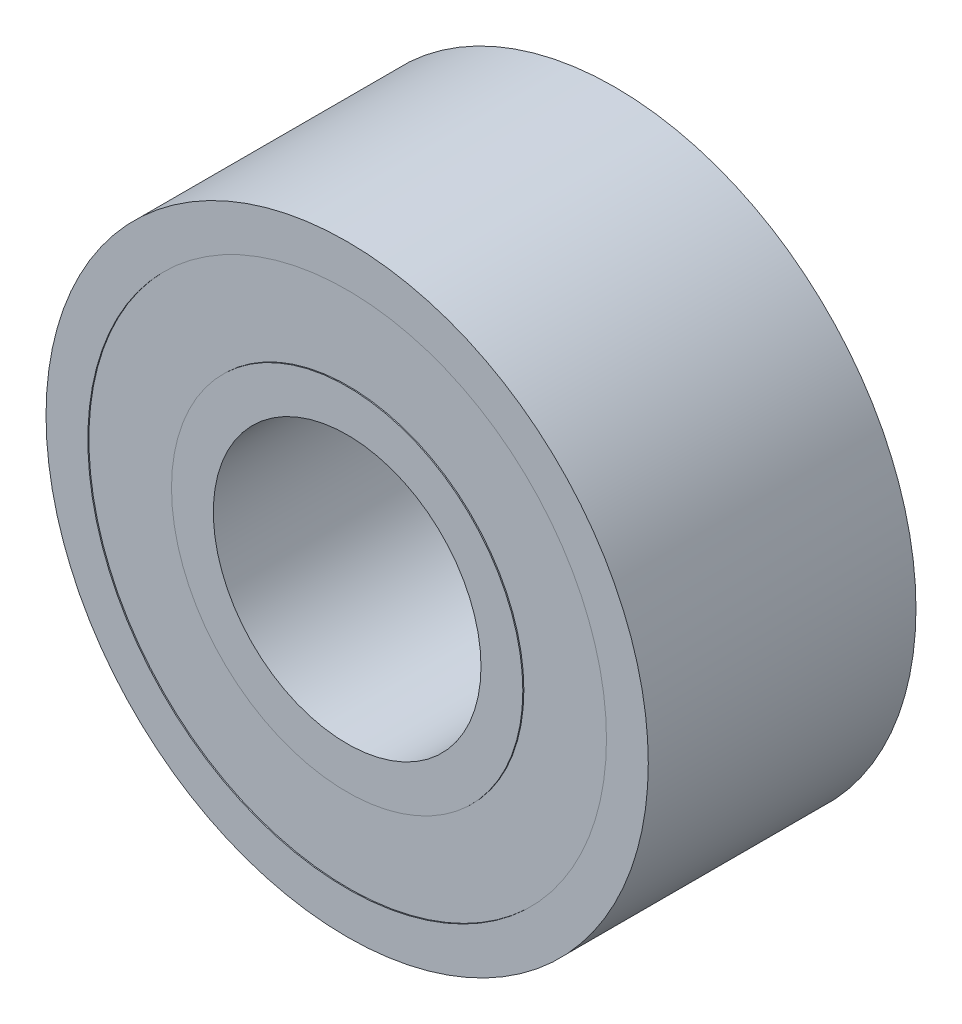
from build123d import *

# Parameters (mm, degrees)
BOSS_EXTRUDE1_DEPTH        = 2
BOSS_EXTRUDE1_DEPTH_BACK   = 2
SKETCH1_R                  = 2.625
SKETCH1_R_2                = 2
BOSS_EXTRUDE1_2_DEPTH      = 2
BOSS_EXTRUDE1_2_DEPTH_BACK = 2
SKETCH1_R_3                = 4.5
SKETCH1_R_4                = 3.875
BOSS_EXTRUDE2_DEPTH        = 1.984375
BOSS_EXTRUDE2_DEPTH_BACK   = 1.984375
SKETCH1_3_R                = 3.875
SKETCH1_3_R_2              = 2.625


with BuildPart() as part:
    # Sketch1 → Boss-Extrude1 (new, two sides: drawn at the far end of the back side and taken through both)
    with BuildSketch(Plane.XY.offset(-BOSS_EXTRUDE1_DEPTH_BACK)):
        Circle(SKETCH1_R)
        Circle(SKETCH1_R_2, mode=Mode.SUBTRACT)
    extrude(amount=BOSS_EXTRUDE1_DEPTH + BOSS_EXTRUDE1_DEPTH_BACK)



with BuildPart() as body_2:
    # Sketch1 → Boss-Extrude1 2 (new, two sides: drawn at the far end of the back side and taken through both)
    with BuildSketch(Plane.XY.offset(-BOSS_EXTRUDE1_2_DEPTH_BACK)):
        Circle(SKETCH1_R_3)
        Circle(SKETCH1_R_4, mode=Mode.SUBTRACT)
    extrude(amount=BOSS_EXTRUDE1_2_DEPTH + BOSS_EXTRUDE1_2_DEPTH_BACK)


with BuildPart() as part_1:
    add(part.part)

    add(body_2.part)  # Boss-Extrude2 merges body 2
    # Sketch1<3> → Boss-Extrude2 (add, two sides: drawn at the far end of the back side and taken through both)
    with BuildSketch(Plane.XY.offset(-BOSS_EXTRUDE2_DEPTH_BACK)):
        Circle(SKETCH1_3_R)
        Circle(SKETCH1_3_R_2, mode=Mode.SUBTRACT)
    extrude(amount=BOSS_EXTRUDE2_DEPTH + BOSS_EXTRUDE2_DEPTH_BACK)


solid = part_1.part
